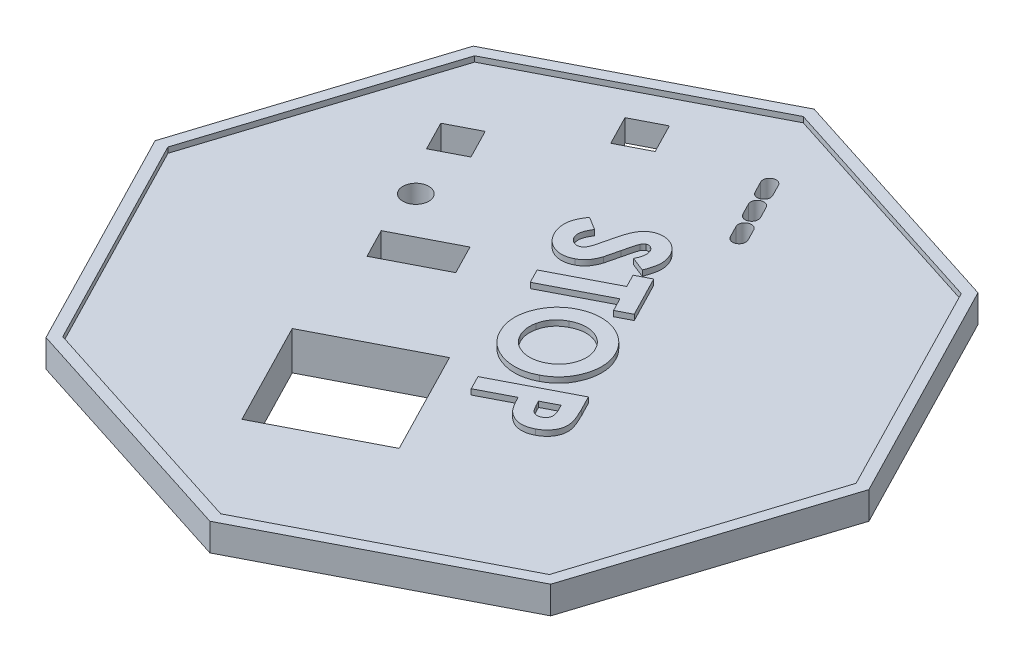
from build123d import *

# Parameters (mm, degrees)
BOSS_EXTRUDE6_DEPTH = 6.35
BOSS_EXTRUDE7_DEPTH = 3.81
CUT_EXTRUDE1_DEPTH  = 1.27
BOSS_EXTRUDE8_DEPTH = 1.27
CUT_EXTRUDE3_DEPTH  = 109.12914547
CUT_EXTRUDE4_DEPTH  = 109.240960824
SKETCH13_R          = 2.999994
CUT_EXTRUDE5_DEPTH  = 109.12914547
CUT_EXTRUDE6_DEPTH  = 109.12914547
CUT_EXTRUDE7_DEPTH  = 109.12914547
CUT_EXTRUDE8_DEPTH  = 109.12914547


with BuildPart() as part:
    # Sketch2 → Boss-Extrude6 (new body)
    with BuildSketch(Plane(origin=(0, 0, 0), x_dir=(1, 0, 0), z_dir=(0, 1, 0))):
        Polygon((76.2, 6.33519086), (49.401880309, 58.361193143), (-6.33519086, 76.2), (-58.361193143, 49.401880309), (-76.2, -6.33519086), (-49.401880309, -58.361193143), (6.33519086, -76.2), (58.361193143, -49.401880309), align=None)
    extrude(amount=BOSS_EXTRUDE6_DEPTH)

    # Sketch3 → Boss-Extrude7 (add)
    with BuildSketch(Plane.XZ):
        Polygon((65.240705841, -5.424046238), (49.967525386, 42.296765633), (5.424046238, 65.240705841), (-42.296765633, 49.967525386), (-65.240705841, 5.424046238), (-49.967525386, -42.296765633), (-5.424046238, -65.240705841), (42.296765633, -49.967525386), align=None)
    extrude(amount=BOSS_EXTRUDE7_DEPTH)

    # Sketch4 → Cut-Extrude1 (cut)
    with BuildSketch(Plane(origin=(0, 6.35, 0), x_dir=(1, 0, 0), z_dir=(0, 1, 0))):
        Polygon((56.262776204, -47.62560164), (73.46017646, 6.107404704), (47.62560164, 56.262776204), (-6.107404704, 73.46017646), (-56.262776204, 47.62560164), (-73.46017646, -6.107404704), (-47.62560164, -56.262776204), (6.107404704, -73.46017646), align=None)
    extrude(amount=-CUT_EXTRUDE1_DEPTH, mode=Mode.SUBTRACT)

    # Sketch5 → Boss-Extrude8 (add)
    # profile 1 of 4: a face of its own
    with BuildSketch(Plane(origin=(0, 5.08, 0), x_dir=(1, 0, 0), z_dir=(0, 1, 0))):
        with BuildLine():
            Line((6.008006492, 24.121099919), (2.691810579, 25.407127563))
            add(Edge.make_bspline(
                [(2.691810579, 25.407127563), (2.777359073, 25.580088164), (2.942013291, 25.912983474), (3.133004361, 26.412653231), (3.266834078, 26.885560596), (3.357809814, 27.329224416), (3.37831457, 27.750426494), (3.355535845, 28.144699408), (3.273782746, 28.515551921), (3.170370644, 28.738811985), (3.119214425, 28.849254967)],
                knots=[0, 0, 0, 0, 1.286176317, 2.47548899, 3.560178005, 4.561617308, 5.487544236, 6.363195347, 7.19030039, 8, 8, 8, 8], degree=3))
            add(Edge.make_bspline(
                [(3.119214425, 28.849254967), (3.063689868, 28.94785419), (2.956708563, 29.137829115), (2.752317713, 29.383414122), (2.515194676, 29.573717138), (2.257627416, 29.709481045), (1.995009704, 29.794042206), (1.740943442, 29.828209242), (1.497598168, 29.802788066), (1.352545388, 29.742106), (1.279851444, 29.711694871)],
                knots=[0, 0, 0, 0, 1.207965687, 2.327434095, 3.391351031, 4.43756837, 5.422336094, 6.326343929, 7.161238688, 8, 8, 8, 8], degree=3))
            add(Edge.make_bspline(
                [(1.279851444, 29.711694871), (1.212141647, 29.671921536), (1.076686359, 29.592353898), (0.899370602, 29.431223458), (0.743339228, 29.239364651), (0.666671185, 29.090036729), (0.627297358, 29.013347515)],
                knots=[0, 0, 0, 0, 0.966681819, 1.933873223, 2.938914868, 4, 4, 4, 4], degree=3))
            add(Edge.make_bspline(
                [(0.627297358, 29.013347515), (0.599936272, 28.947450321), (0.536932404, 28.795710066), (0.44707321, 28.530185403), (0.345474803, 28.198962299), (0.228952107, 27.800336746), (0.111448061, 27.331555893), (-0.029480956, 26.797565217), (-0.171665617, 26.194837664), (-0.270832709, 25.770943117), (-0.322912979, 25.548323477)],
                knots=[0, 0, 0, 0, 0.476082896, 1.096267321, 1.869586835, 2.788473471, 3.867417338, 5.094584806, 6.474142951, 8, 8, 8, 8], degree=3))
            add(Edge.make_bspline(
                [(-0.322912979, 25.548323477), (-0.369806633, 25.339671688), (-0.458784906, 24.943765753), (-0.587671016, 24.382578927), (-0.708459581, 23.886109278), (-0.807775143, 23.450812196), (-0.905388159, 23.080525152), (-0.985827707, 22.772829977), (-1.046877827, 22.52670259), (-1.093108796, 22.387123003), (-1.112846873, 22.327530208)],
                knots=[0, 0, 0, 0, 1.547364538, 2.93604387, 4.166088955, 5.244351007, 6.166296388, 6.936453265, 7.545924122, 8, 8, 8, 8], degree=3))
            add(Edge.make_bspline(
                [(-1.112846873, 22.327530208), (-1.192753871, 22.091908656), (-1.34620867, 21.639416898), (-1.631430611, 21.013312971), (-1.933817559, 20.458407565), (-2.271500671, 19.976820835), (-2.643672119, 19.551372395), (-3.064241223, 19.177811633), (-3.526005194, 18.83737909), (-3.864478726, 18.651435612), (-4.035983892, 18.557217708)],
                knots=[0, 0, 0, 0, 1.215352445, 2.33398414, 3.358161732, 4.299935058, 5.202986948, 6.114305126, 7.044514912, 8, 8, 8, 8], degree=3))
            add(Edge.make_bspline(
                [(-4.035983892, 18.557217708), (-4.207473216, 18.473621556), (-4.543974545, 18.309586762), (-5.066294439, 18.126446889), (-5.588037609, 18.000358512), (-6.110660716, 17.924078779), (-6.634373278, 17.91518465), (-7.158325624, 17.957776322), (-7.683621035, 18.052053071), (-8.203544757, 18.209504597), (-8.709181432, 18.418982113), (-9.193156155, 18.675623042), (-9.650611412, 18.981284766), (-10.072406749, 19.342802859), (-10.470713631, 19.74788746), (-10.839937972, 20.202537568), (-11.181057526, 20.707038958), (-11.377398776, 21.070237266), (-11.477390142, 21.255204487)],
                knots=[0, 0, 0, 0, 1.030293912, 2.021672625, 2.983660747, 3.927600384, 4.869560662, 5.807474128, 6.76475993, 7.74776233, 8.737089436, 9.718046794, 10.70371339, 11.703563652, 12.714622269, 13.769950882, 14.864295408, 16, 16, 16, 16], degree=3))
            add(Edge.make_bspline(
                [(-11.477390142, 21.255204487), (-11.550505827, 21.404438986), (-11.694203239, 21.697735992), (-11.874961084, 22.14754909), (-12.018768382, 22.596742316), (-12.133169297, 23.046045209), (-12.20205022, 23.496065481), (-12.247913691, 23.944497588), (-12.249464702, 24.39255348), (-12.220545827, 24.841950326), (-12.149138773, 25.293009927), (-12.048271052, 25.749677468), (-11.899547857, 26.207083908), (-11.72106092, 26.670710592), (-11.500849008, 27.137461389), (-11.246387667, 27.609773493), (-10.95021897, 28.085214477), (-10.730998783, 28.396201327), (-10.618766344, 28.555414823)],
                knots=[0, 0, 0, 0, 1.022280858, 2.009132714, 2.979395538, 3.92283388, 4.858284437, 5.778050868, 6.693812492, 7.611678818, 8.54591712, 9.50097142, 10.486145853, 11.502115348, 12.55605452, 13.659180214, 14.801588869, 16, 16, 16, 16], degree=3))
            Line((-10.618766344, 28.555414823), (-7.607858892, 26.704603525))
            add(Edge.make_bspline(
                [(-7.607858892, 26.704603525), (-7.73209091, 26.513274248), (-7.969467452, 26.147691503), (-8.257351337, 25.590342922), (-8.4750493, 25.060069766), (-8.617157881, 24.550557558), (-8.680825746, 24.064382987), (-8.666757536, 23.601601644), (-8.577055678, 23.162067409), (-8.457511936, 22.893110166), (-8.397792787, 22.75875016)],
                knots=[0, 0, 0, 0, 1.29526762, 2.474934838, 3.557830899, 4.546529289, 5.47151309, 6.331918385, 7.166694844, 8, 8, 8, 8], degree=3))
            add(Edge.make_bspline(
                [(-8.397792787, 22.75875016), (-8.323609252, 22.628260095), (-8.18020688, 22.376012949), (-7.891767282, 22.058850468), (-7.570922792, 21.796184945), (-7.207003846, 21.614035948), (-6.836262522, 21.491753788), (-6.469445756, 21.457094322), (-6.117033353, 21.494289022), (-5.905475664, 21.586566884), (-5.799024758, 21.632998958)],
                knots=[0, 0, 0, 0, 1.147266879, 2.217753488, 3.265438254, 4.307709533, 5.319242763, 6.239995554, 7.11440672, 8, 8, 8, 8], degree=3))
            add(Edge.make_bspline(
                [(-5.799024758, 21.632998958), (-5.70640273, 21.686976072), (-5.516311001, 21.797755369), (-5.269550888, 22.030864221), (-5.054067509, 22.316864121), (-4.895211997, 22.594198268), (-4.777026431, 22.856386389), (-4.68579395, 23.100339541), (-4.591387382, 23.384123815), (-4.496176195, 23.711639612), (-4.398307508, 24.079682342), (-4.295144923, 24.489280142), (-4.187405899, 24.939152492), (-4.120475715, 25.254318648), (-4.085593267, 25.418575881)],
                knots=[0, 0, 0, 0, 0.898886853, 1.844819871, 2.828676222, 3.901705031, 4.523858531, 5.244775346, 6.090167515, 7.037610404, 8.111491415, 9.291557141, 10.588422896, 12, 12, 12, 12], degree=3))
            add(Edge.make_bspline(
                [(-4.085593267, 25.418575881), (-4.018352464, 25.731828578), (-3.889335355, 26.332876679), (-3.680770386, 27.192007631), (-3.482479912, 27.976268487), (-3.274428232, 28.68124986), (-3.075565176, 29.311519382), (-2.873315972, 29.862967898), (-2.673308293, 30.338102291), (-2.467709792, 30.742798131), (-2.255688471, 31.096254134), (-2.033652488, 31.416255371), (-1.802307386, 31.715922245), (-1.553409138, 31.986395294), (-1.293898638, 32.232170877), (-1.020827903, 32.449798414), (-0.737994093, 32.647694018), (-0.537661476, 32.758654019), (-0.437396152, 32.814188862)],
                knots=[0, 0, 0, 0, 1.804861184, 3.463045648, 4.980422122, 6.361494372, 7.60342172, 8.703032402, 9.669408668, 10.505893091, 11.25803808, 11.98955346, 12.699153125, 13.388973075, 14.058160614, 14.710640109, 15.354682782, 16, 16, 16, 16], degree=3))
            add(Edge.make_bspline(
                [(-0.437396152, 32.814188862), (-0.291309618, 32.885145614), (-0.003953794, 33.024719299), (0.447349471, 33.170742637), (0.901359261, 33.277057528), (1.362354065, 33.331243285), (1.830400041, 33.328041053), (2.304134538, 33.285086251), (2.782262148, 33.181609172), (3.260607229, 33.038820902), (3.727467716, 32.849288712), (4.170865973, 32.616376758), (4.585325645, 32.342993349), (4.973533395, 32.033751904), (5.328757454, 31.680503607), (5.654750828, 31.287646778), (5.95420631, 30.856921716), (6.124052463, 30.5453088), (6.210260098, 30.387145592)],
                knots=[0, 0, 0, 0, 0.988852534, 1.945097373, 2.883669758, 3.828116658, 4.766304644, 5.7322451, 6.722191364, 7.742610139, 8.77209114, 9.788288717, 10.790427194, 11.794273939, 12.808576618, 13.838057618, 14.902677889, 16, 16, 16, 16], degree=3))
            add(Edge.make_bspline(
                [(6.210260098, 30.387145592), (6.311039473, 30.175646049), (6.51161538, 29.754709594), (6.716542012, 29.084367093), (6.838874709, 28.392332267), (6.873093296, 27.798976781), (6.860385137, 27.306460537), (6.814430329, 26.914562677), (6.75197436, 26.499743265), (6.652295331, 26.0656124), (6.537096797, 25.607065625), (6.384731559, 25.129737198), (6.210843396, 24.630202206), (6.076736444, 24.293605883), (6.008006492, 24.121099919)],
                knots=[0, 0, 0, 0, 1.297413127, 2.582173336, 3.871415729, 5.185358534, 5.869718678, 6.60019346, 7.371174727, 8.19419373, 9.068201133, 9.991594554, 10.970690134, 12, 12, 12, 12], degree=3))
        make_face()
    # profile 2 of 4: a face of its own
    with BuildSketch(Plane(origin=(0, 5.08, 0), x_dir=(1, 0, 0), z_dir=(0, 1, 0))):
        Polygon((9.149286459, 23.62819854), (13.953763623, 14.320716568), (10.794028046, 12.691239405), (9.210344152, 15.759388443), (-4.470395031, 8.695776665), (-6.149481569, 11.94709878), (7.531257613, 19.010710559), (5.989550882, 21.998721376), align=None)
    # profile 3 of 4: a face of its own
    with BuildSketch(Plane(origin=(0, 5.08, 0), x_dir=(1, 0, 0), z_dir=(0, 1, 0))):
        with BuildLine():
            add(Edge.make_bspline(
                [(19.570278732, 4.462532703), (19.713650989, 4.166188303), (19.996752537, 3.581029362), (20.313054768, 2.667227072), (20.531805096, 1.742725175), (20.655950786, 0.808019578), (20.676952333, -0.137119359), (20.60489098, -1.092343719), (20.429194576, -2.057671945), (20.164806113, -3.022291967), (19.813159492, -3.959681005), (19.385605379, -4.848866497), (18.875008778, -5.672737756), (18.288343748, -6.436095426), (17.624402821, -7.139316165), (16.880781216, -7.775626916), (16.063733648, -8.355966147), (15.471518371, -8.679615294), (15.17030878, -8.844228114)],
                knots=[0, 0, 0, 0, 1.013230412, 2.000715501, 2.970929077, 3.935032886, 4.899073012, 5.877415428, 6.880292345, 7.916262162, 8.953919566, 9.95966958, 10.950111159, 11.933523389, 12.920114358, 13.922960666, 14.943586578, 16, 16, 16, 16], degree=3))
            add(Edge.make_bspline(
                [(15.17030878, -8.844228114), (14.865196383, -8.993043246), (14.264066392, -9.28623762), (13.327151568, -9.610899919), (12.389144061, -9.848577588), (11.443705056, -9.981525686), (10.49243392, -10.021489279), (9.534962234, -9.957877463), (8.572244252, -9.80123521), (7.617233615, -9.545142958), (6.690989441, -9.205788096), (5.814468938, -8.788776029), (5.00068871, -8.294541732), (4.250243437, -7.722552262), (3.558168018, -7.079489211), (2.93508113, -6.355531679), (2.368735628, -5.561371164), (2.053697339, -4.984558736), (1.894076809, -4.692305037)],
                knots=[0, 0, 0, 0, 1.050996748, 2.070665337, 3.065769652, 4.045099452, 5.023342109, 6.010689009, 7.013072396, 8.040791056, 9.069506827, 10.065539531, 11.04363132, 12.014005785, 12.984436277, 13.965129252, 14.968991521, 16, 16, 16, 16], degree=3))
            add(Edge.make_bspline(
                [(1.894076809, -4.692305037), (1.741495365, -4.378285698), (1.441996167, -3.761903146), (1.107330523, -2.805640146), (0.870025127, -1.848900784), (0.740360794, -0.889258552), (0.712535761, 0.074134467), (0.791584153, 1.038093508), (0.965676853, 2.005947509), (1.25222009, 2.960122502), (1.612185982, 3.887442121), (2.053082856, 4.762931755), (2.566814473, 5.574783346), (3.147897105, 6.327573091), (3.805251928, 7.014416907), (4.534405042, 7.636420548), (5.329432632, 8.204874308), (5.906341536, 8.519777498), (6.198644117, 8.679329578)],
                knots=[0, 0, 0, 0, 1.070016023, 2.100313972, 3.10045601, 4.088618399, 5.064318796, 6.050530876, 7.049896506, 8.074528449, 9.101097015, 10.097328049, 11.075762236, 12.043403677, 13.009171566, 13.985807453, 14.97946855, 16, 16, 16, 16], degree=3))
            add(Edge.make_bspline(
                [(6.198644117, 8.679329578), (6.399667359, 8.778709907), (6.798743576, 8.976002147), (7.415376212, 9.222436229), (8.036534062, 9.430573439), (8.666151107, 9.589188145), (9.299969872, 9.713972703), (9.942913999, 9.790365978), (10.591942226, 9.818453368), (11.244429222, 9.812271898), (11.893364867, 9.763018715), (12.533383027, 9.671314747), (13.161800992, 9.536942997), (13.777511126, 9.362181482), (14.381656674, 9.146494883), (14.973479629, 8.89095244), (15.552787701, 8.592663876), (16.117966026, 8.257148683), (16.65965902, 7.886052822), (17.172120274, 7.483230902), (17.656835439, 7.056672411), (18.101733074, 6.59241023), (18.518809095, 6.103367381), (18.905934703, 5.587371051), (19.258902072, 5.040009678), (19.465932235, 4.656052986), (19.570278732, 4.462532703)],
                knots=[0, 0, 0, 0, 1.035318343, 2.055339089, 3.064115048, 4.058677938, 5.051851773, 6.045789829, 7.045613529, 8.050275516, 9.057767663, 10.048941321, 11.034107599, 12.023451477, 13.002714505, 13.994740906, 14.998423347, 16.009983838, 17.028429993, 18.028547066, 19.018936946, 20.007757408, 20.99544285, 21.98593727, 22.984880334, 24, 24, 24, 24], degree=3))
        make_face()
        with BuildLine():
            add(Edge.make_bspline(
                [(16.414359261, 2.875032703), (16.311282815, 3.064315205), (16.10905216, 3.435677684), (15.744677015, 3.946892459), (15.34541408, 4.408970915), (14.905472509, 4.822193502), (14.427055837, 5.185068094), (13.909388096, 5.501740474), (13.348661616, 5.75797443), (12.761201836, 5.972200716), (12.153084647, 6.128631545), (11.535392337, 6.221369239), (10.915160311, 6.246769045), (10.293672131, 6.213523575), (9.671062382, 6.112538185), (9.046697583, 5.946348793), (8.419252143, 5.717953799), (8.012237964, 5.520700925), (7.805224646, 5.420375251)],
                knots=[0, 0, 0, 0, 1.030033604, 2.020872659, 2.995535739, 3.946732672, 4.901909728, 5.862862385, 6.842714211, 7.845361764, 8.850221774, 9.840537722, 10.827034091, 11.814130587, 12.812319975, 13.837906191, 14.900327713, 16, 16, 16, 16], degree=3))
            add(Edge.make_bspline(
                [(7.805224646, 5.420375251), (7.580976575, 5.29790047), (7.142142692, 5.058228023), (6.545982842, 4.625843215), (6.01298903, 4.157154979), (5.557016517, 3.636139163), (5.164346968, 3.076905477), (4.840909059, 2.473039729), (4.590272305, 1.822382331), (4.480144068, 1.366605275), (4.424154934, 1.134888472)],
                knots=[0, 0, 0, 0, 1.083313658, 2.119950187, 3.117817061, 4.089243028, 5.050628692, 6.011787016, 6.989193621, 8, 8, 8, 8], degree=3))
            add(Edge.make_bspline(
                [(4.424154934, 1.134888472), (4.388820505, 0.952224579), (4.318792658, 0.590210541), (4.276581358, 0.04305365), (4.273817592, -0.497002861), (4.325429499, -1.030700519), (4.420642481, -1.558006794), (4.56203005, -2.079485013), (4.753794602, -2.593739089), (4.914956332, -2.925399452), (4.996570799, -3.09335672)],
                knots=[0, 0, 0, 0, 1.024547263, 2.03050797, 3.01892523, 3.997574614, 4.980707781, 5.968727227, 6.97133615, 8, 8, 8, 8], degree=3))
            add(Edge.make_bspline(
                [(4.996570799, -3.09335672), (5.097056309, -3.277590916), (5.294978302, -3.6404691), (5.65480326, -4.138830539), (6.052857976, -4.590645242), (6.489255072, -4.998619771), (6.969364411, -5.355508919), (7.491650298, -5.660447747), (8.052384964, -5.921413202), (8.64621846, -6.132713937), (9.260451631, -6.290237306), (9.880911138, -6.379042816), (10.498127324, -6.418945153), (11.112816126, -6.379262936), (11.727057306, -6.290396235), (12.338290766, -6.130533035), (12.94872929, -5.914488924), (13.341501752, -5.723948943), (13.540831617, -5.627250951)],
                knots=[0, 0, 0, 0, 1.013919681, 1.997074046, 2.964537584, 3.922016873, 4.880325577, 5.85083453, 6.841483391, 7.866757427, 8.894611235, 9.901923555, 10.893755599, 11.879446447, 12.874591526, 13.890524137, 14.9294526, 16, 16, 16, 16], degree=3))
            add(Edge.make_bspline(
                [(13.540831617, -5.627250951), (13.734957111, -5.519956369), (14.116343141, -5.30916152), (14.646698684, -4.938687327), (15.129472619, -4.531971857), (15.557192342, -4.080623968), (15.944581261, -3.599724307), (16.271278032, -3.071609884), (16.555708518, -2.509332445), (16.785672026, -1.914594715), (16.960273688, -1.303959081), (17.077110997, -0.691023044), (17.127585142, -0.080772345), (17.111007509, 0.524012159), (17.03633382, 1.123231548), (16.890237168, 1.715051926), (16.691852289, 2.305533775), (16.507689603, 2.683490846), (16.414359261, 2.875032703)],
                knots=[0, 0, 0, 0, 1.064669855, 2.091689239, 3.101575926, 4.091077618, 5.073823274, 6.062041663, 7.067483568, 8.09649981, 9.119459057, 10.113983585, 11.088606134, 12.054187283, 13.015041052, 13.982649417, 14.97764295, 16, 16, 16, 16], degree=3))
        make_face(mode=Mode.SUBTRACT)
    # profile 4 of 4: a face of its own
    with BuildSketch(Plane(origin=(0, 5.08, 0), x_dir=(1, 0, 0), z_dir=(0, 1, 0))):
        with BuildLine():
            Line((25.210067513, -7.548719749), (26.965476167, -10.94886999))
            add(Edge.make_bspline(
                [(26.965476167, -10.94886999), (27.078793405, -11.172076053), (27.296967363, -11.601823117), (27.589735992, -12.23286121), (27.848300167, -12.820359), (28.062798722, -13.370165327), (28.235729021, -13.880591576), (28.366337655, -14.352128098), (28.460830411, -14.782315314), (28.512117112, -15.179568163), (28.526696198, -15.553596585), (28.515471141, -15.915775887), (28.478332752, -16.273453154), (28.408230526, -16.623935261), (28.314077278, -16.969370806), (28.185652133, -17.306367688), (28.032634361, -17.639107835), (27.854285722, -17.966420799), (27.648555005, -18.28357088), (27.414581092, -18.584528975), (27.158267129, -18.872677821), (26.874776833, -19.144203279), (26.563409108, -19.399808533), (26.229549766, -19.643891484), (25.867536158, -19.87012977), (25.614077053, -20.007131694), (25.484827128, -20.07699499)],
                knots=[0, 0, 0, 0, 1.69235774, 3.258360287, 4.70276052, 6.031588917, 7.247307647, 8.344842648, 9.338379056, 10.222727903, 11.049093818, 11.866550109, 12.671008723, 13.47725834, 14.280612812, 15.088924043, 15.912465533, 16.75535996, 17.606984753, 18.465400679, 19.33034066, 20.212344416, 21.116421865, 22.05225916, 23.006761436, 24, 24, 24, 24], degree=3))
            add(Edge.make_bspline(
                [(25.484827128, -20.07699499), (25.339361557, -20.147449994), (25.053567959, -20.285871677), (24.618703991, -20.459630693), (24.184860846, -20.587776587), (23.75728335, -20.686660301), (23.33017511, -20.739698459), (22.907678419, -20.753641015), (22.48833391, -20.737527955), (22.076354927, -20.6736354), (21.671347969, -20.579451635), (21.277603973, -20.448238801), (20.894897503, -20.287503808), (20.522537844, -20.096554259), (20.163915009, -19.869889781), (19.816205476, -19.613133538), (19.477461824, -19.326971938), (19.267998978, -19.113278545), (19.161539869, -19.004669269)],
                knots=[0, 0, 0, 0, 1.118317055, 2.19713746, 3.23585468, 4.245982025, 5.230786142, 6.208483658, 7.168951145, 8.129983164, 9.088633838, 10.04339709, 10.998119765, 11.958708252, 12.935612954, 13.930319963, 14.948088898, 16, 16, 16, 16], degree=3))
            add(Edge.make_bspline(
                [(19.161539869, -19.004669269), (19.095687336, -18.930426451), (18.953328998, -18.769930204), (18.745743659, -18.49266831), (18.518348727, -18.166895905), (18.281490863, -17.784421708), (18.022089003, -17.353130517), (17.741858282, -16.873246702), (17.453630785, -16.336451886), (17.256948131, -15.960870838), (17.154268234, -15.764795471)],
                knots=[0, 0, 0, 0, 0.623240368, 1.347305269, 2.174191932, 3.118720344, 4.172669393, 5.336397453, 6.609443024, 8, 8, 8, 8], degree=3))
            Line((17.154268234, -15.764795471), (10.021966551, -19.447337538))
            Line((10.021966551, -19.447337538), (8.369592753, -16.241808692))
            Line((8.369592753, -16.241808692), (25.210067513, -7.548719749))
        make_face()
        with BuildLine():
            Line((20.279658859, -14.15058273), (20.806281455, -15.169482971))
            add(Edge.make_bspline(
                [(20.806281455, -15.169482971), (20.903685006, -15.353659546), (21.082486663, -15.691748624), (21.352977234, -16.141685781), (21.596109035, -16.490143057), (21.822455367, -16.747637824), (22.047569413, -16.930189693), (22.282637346, -17.059509496), (22.53049136, -17.153319567), (22.790584682, -17.20672778), (23.061284488, -17.218796654), (23.337113019, -17.183413815), (23.615751512, -17.101521006), (23.794028815, -17.017690959), (23.885878811, -16.974500999)],
                knots=[0, 0, 0, 0, 1.829472656, 3.358324582, 4.607592963, 5.556677668, 6.359211714, 7.139352375, 7.902920786, 8.678489095, 9.461184983, 10.271764684, 11.109598335, 12, 12, 12, 12], degree=3))
            add(Edge.make_bspline(
                [(23.885878811, -16.974500999), (23.963375312, -16.931847908), (24.113389977, -16.849281739), (24.313532301, -16.69777456), (24.48721911, -16.533203624), (24.632482663, -16.353823068), (24.751189087, -16.159762869), (24.832313245, -15.948370982), (24.893760938, -15.723478218), (24.906078619, -15.566779923), (24.912411263, -15.486219749)],
                knots=[0, 0, 0, 0, 1.11589026, 2.160096261, 3.159987208, 4.130938992, 5.06766437, 6.019286455, 6.981695192, 8, 8, 8, 8], degree=3))
            add(Edge.make_bspline(
                [(24.912411263, -15.486219749), (24.914090126, -15.422536903), (24.917697271, -15.285710212), (24.886291527, -15.068747944), (24.837637813, -14.827295832), (24.758626496, -14.562698896), (24.655943608, -14.273378734), (24.524222409, -13.961464689), (24.372566291, -13.624361419), (24.255804045, -13.395767526), (24.194983378, -13.276694509)],
                knots=[0, 0, 0, 0, 0.650641252, 1.397944579, 2.235024325, 3.16986698, 4.219397908, 5.374538111, 6.632414616, 8, 8, 8, 8], degree=3))
            Line((24.194983378, -13.276694509), (23.725602369, -12.372277442))
            Line((23.725602369, -12.372277442), (20.279658859, -14.15058273))
        make_face(mode=Mode.SUBTRACT)
    extrude(amount=BOSS_EXTRUDE8_DEPTH)

    # Sketch10 → Cut-Extrude3 (cut, through all)
    with BuildSketch(Plane(origin=(0, 5.08, 0), x_dir=(1, 0, 0), z_dir=(0, 1, 0))):
        Polygon((0, -14.453878169), (12.363677867, -38.45678361), (-11.639227574, -50.820461476), (-24.002905441, -26.817556035), align=None)
    extrude(amount=-CUT_EXTRUDE3_DEPTH, mode=Mode.SUBTRACT)

    # Sketch11 → Cut-Extrude4 (cut, through all)
    with BuildSketch(Plane(origin=(0, 6.35, 0), x_dir=(1, 0, 0), z_dir=(0, 1, 0))):
        with BuildLine():
            Line((7.924067167, 49.547543366), (6.52834531, 52.257204692))
            ThreePointArc((6.52834531, 52.257204692), (4.475653719, 52.914174426), (3.818683985, 50.861482835))
            Line((3.818683985, 50.861482835), (5.214405841, 48.151821509))
            ThreePointArc((5.214405841, 48.151821509), (7.267097433, 47.494851775), (7.924067167, 49.547543366))
        make_face()
        with BuildLine():
            Line((4.920654764, 55.378383079), (3.524932907, 58.088044405))
            ThreePointArc((3.524932907, 58.088044405), (1.472241316, 58.745014139), (0.815271582, 56.692322548))
            Line((0.815271582, 56.692322548), (2.210993439, 53.982661222))
            ThreePointArc((2.210993439, 53.982661222), (4.26368503, 53.325691488), (4.920654764, 55.378383079))
        make_face()
        with BuildLine():
            Line((10.988829534, 43.597598527), (9.593107678, 46.307259853))
            ThreePointArc((9.593107678, 46.307259853), (7.540416086, 46.964229587), (6.883446352, 44.911537996))
            Line((6.883446352, 44.911537996), (8.279168209, 42.201876671))
            ThreePointArc((8.279168209, 42.201876671), (10.3318598, 41.544906936), (10.988829534, 43.597598527))
        make_face()
    extrude(amount=-CUT_EXTRUDE4_DEPTH, mode=Mode.SUBTRACT)

    # Sketch13 → Cut-Extrude5 (cut, through all)
    with BuildSketch(Plane(origin=(0, 5.08, 0), x_dir=(1, 0, 0), z_dir=(0, 1, 0))):
        with Locations(Location((-36.69849918, 14.453878169, 0), (0, 0, 270))):
            Circle(SKETCH13_R)
    extrude(amount=-CUT_EXTRUDE5_DEPTH, mode=Mode.SUBTRACT)

    # Sketch16 → Cut-Extrude6 (cut, through all)
    with BuildSketch(Plane(origin=(0, 5.08, 0), x_dir=(1, 0, 0), z_dir=(0, 1, 0))):
        Polygon((-33.313763223, 3.072274184), (-29.82445858, -3.701879129), (-16.276151953, 3.276730156), (-19.765456596, 10.050883469), align=None)
    extrude(amount=-CUT_EXTRUDE6_DEPTH, mode=Mode.SUBTRACT)

    # Sketch18 → Cut-Extrude7 (cut, through all)
    with BuildSketch(Plane(origin=(0, 5.08, 0), x_dir=(1, 0, 0), z_dir=(0, 1, 0))):
        Polygon((-47.945861631, 31.479102498), (-44.456556988, 24.704949185), (-37.682403675, 28.194253828), (-41.171708317, 34.968407141), align=None)
    extrude(amount=-CUT_EXTRUDE7_DEPTH, mode=Mode.SUBTRACT)

    # Sketch19 → Cut-Extrude8 (cut, through all)
    with BuildSketch(Plane(origin=(0, 5.08, 0), x_dir=(1, 0, 0), z_dir=(0, 1, 0))):
        Polygon((-27.754874945, 53.883451673), (-24.265570303, 47.10929836), (-17.491416989, 50.598603002), (-20.980721632, 57.372756315), align=None)
    extrude(amount=-CUT_EXTRUDE8_DEPTH, mode=Mode.SUBTRACT)


solid = part.part
